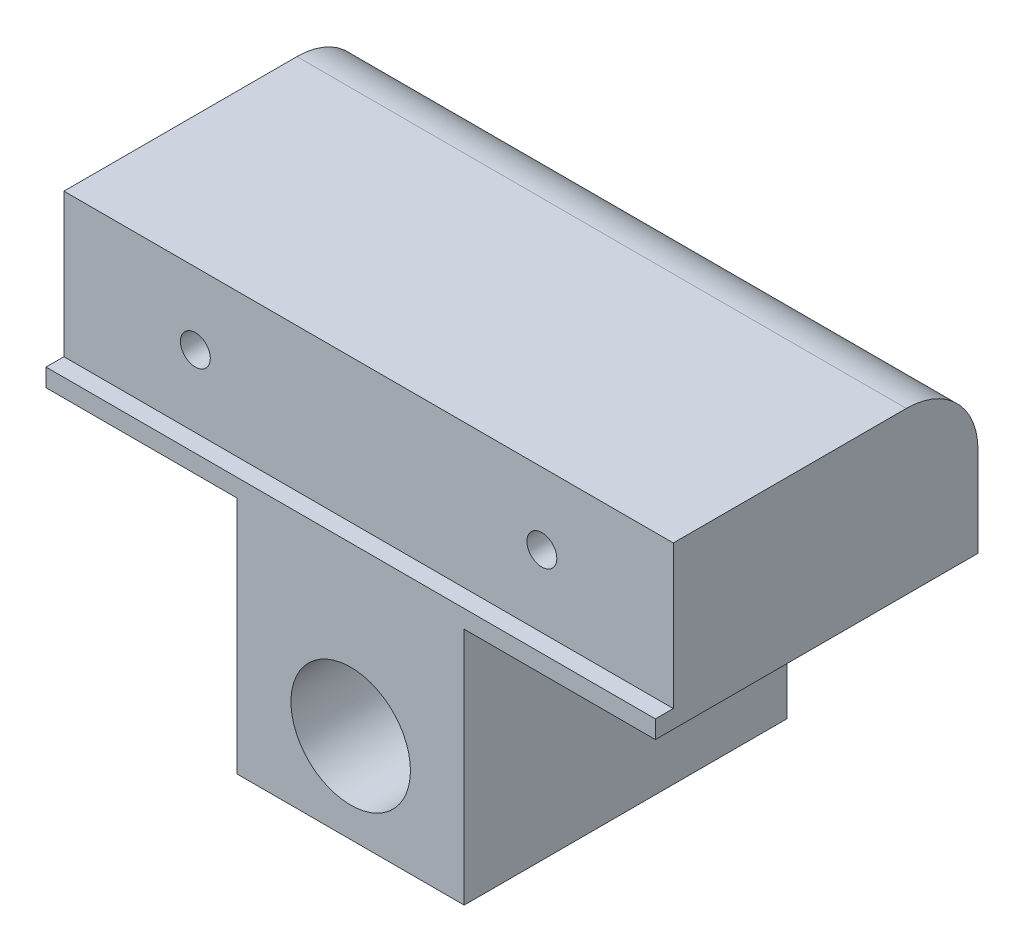
from build123d import *

# Parameters (mm, degrees)
EXTRUDE1_DEPTH        = 102
SKETCH3_W             = 38
SKETCH3_H             = 40
EXTRUDE3_DEPTH        = 54
SKETCH4_R             = 10
EXTRUDE4_DEPTH        = 127.585939188
M6_TAPPED_HOLE1_D     = 5
M6_TAPPED_HOLE1_DEPTH = 14
M6_TAPPED_HOLE1_TIP   = 1.502151548
M6_TAPPED_HOLE2_D     = 5
M6_TAPPED_HOLE2_DEPTH = 10
M6_TAPPED_HOLE2_TIP   = 1.502151548


with BuildPart() as part:
    # Sketch1 → Extrude1 (new body)
    with BuildSketch(Plane(origin=(0, 0, 0), x_dir=(0, 0, -1), z_dir=(1, 0, 0))):
        with BuildLine():
            Line((-5.361015491, 52), (-5.361015491, 28))
            Line((-5.361015491, 28), (-8.361015491, 28))
            Line((-8.361015491, 28), (-8.361015491, 25))
            Line((-8.361015491, 25), (45.638984509, 25))
            Line((45.638984509, 25), (45.638984509, 40))
            ThreePointArc((45.638984509, 40), (42.124265884, 48.485281374), (33.638984509, 52))
            Line((33.638984509, 52), (-5.361015491, 52))
        make_face()
    extrude(amount=EXTRUDE1_DEPTH)

    # Sketch3 → Extrude3 (add)
    with BuildSketch(Plane.XY.offset(8.361015491)):
        with Locations((51, 5)):
            Rectangle(SKETCH3_W, SKETCH3_H)
    extrude(amount=-EXTRUDE3_DEPTH)

    # Sketch4 → Extrude4 (cut, through all)
    with BuildSketch(Plane.XY.offset(8.361015491)):
        with Locations((51, 0)):
            Circle(SKETCH4_R)
    extrude(amount=-EXTRUDE4_DEPTH, mode=Mode.SUBTRACT)

    # M6 Tapped Hole1
    with Locations(Plane(origin=(22, 40, 5.361015491), x_dir=(1, 0, 0), z_dir=(0, 0, 1))):
        with Locations((0, 0), (58, 0)):
            Hole(M6_TAPPED_HOLE1_D / 2, depth=M6_TAPPED_HOLE1_DEPTH)
            with Locations((0, 0, -(M6_TAPPED_HOLE1_DEPTH + M6_TAPPED_HOLE1_TIP / 2))):  # 118° drill point
                Cone(0, M6_TAPPED_HOLE1_D / 2, M6_TAPPED_HOLE1_TIP, mode=Mode.SUBTRACT)

    # M6 Tapped Hole2
    with Locations(Plane(origin=(39, -15, -18.638984509), x_dir=(-1, 0, 0), z_dir=(0, -1, 0))):
        with Locations((0, 0), (-24, 0)):
            Hole(M6_TAPPED_HOLE2_D / 2, depth=M6_TAPPED_HOLE2_DEPTH)
            with Locations((0, 0, -(M6_TAPPED_HOLE2_DEPTH + M6_TAPPED_HOLE2_TIP / 2))):  # 118° drill point
                Cone(0, M6_TAPPED_HOLE2_D / 2, M6_TAPPED_HOLE2_TIP, mode=Mode.SUBTRACT)


solid = part.part
